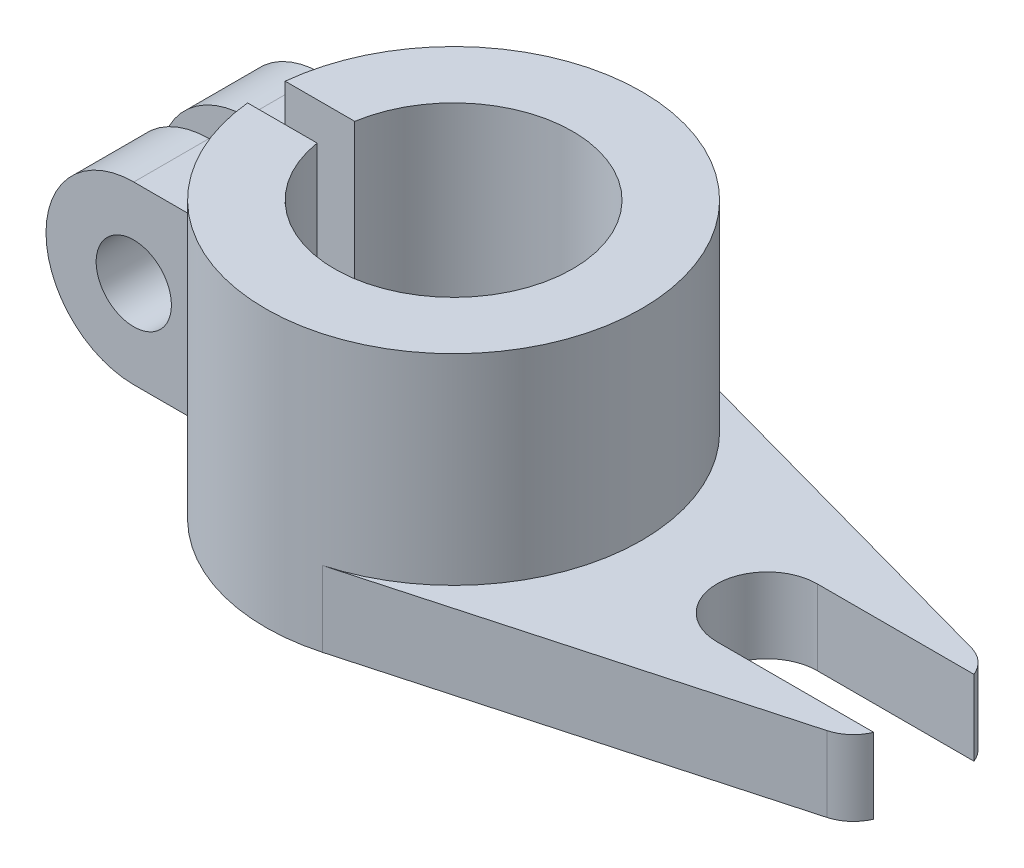
from build123d import *

# Parameters (mm, degrees)
SKETCH1_R           = 30
BOSS_EXTRUDE1_DEPTH = 44
BOSS_EXTRUDE2_DEPTH = 12
BOSS_EXTRUDE3_DEPTH = 15
CUT_EXTRUDE1_DEPTH  = 92.983694207
SKETCH5_R           = 6
CUT_EXTRUDE2_DEPTH  = 98.908120194


with BuildPart() as part:
    # Sketch1 → Boss-Extrude1 (new body)
    with BuildSketch(Plane(origin=(0, 0, 0), x_dir=(1, 0, 0), z_dir=(0, 1, 0))):
        with Locations(Location((0, 0, 0), (0, 0, 270))):
            Circle(SKETCH1_R)
    extrude(amount=BOSS_EXTRUDE1_DEPTH)

    # Sketch2 → Boss-Extrude2 (add)
    with BuildSketch(Plane(origin=(0, 0, 0), x_dir=(1, 0, 0), z_dir=(0, 1, 0))):
        with BuildLine():
            Line((50, 8), (75, 8))
            ThreePointArc((75, 8), (73.430488051, 10.198766547), (71.055490967, 11.486140207))
            Line((71.055490967, 11.486140207), (7.99189246, 28.915906607))
            ThreePointArc((7.99189246, 28.915906607), (30, 0), (7.99189246, -28.915906607))
            Line((7.99189246, -28.915906607), (71.055490967, -11.486140207))
            ThreePointArc((71.055490967, -11.486140207), (73.430488051, -10.198766547), (75, -8))
            Line((75, -8), (50, -8))
            ThreePointArc((50, -8), (42, 0), (50, 8))
        make_face()
    extrude(amount=BOSS_EXTRUDE2_DEPTH)

    # Sketch3 → Boss-Extrude3 (add, symmetric)
    with BuildSketch(Plane.XY):
        with BuildLine():
            Line((-36, 36), (-23.901481141, 36))
            Line((-23.901481141, 36), (-23.901481141, 8))
            Line((-23.901481141, 8), (-36, 8))
            ThreePointArc((-36, 8), (-50, 22), (-36, 36))
        make_face()
    extrude(amount=BOSS_EXTRUDE3_DEPTH, both=True)

    # Sketch4 → Cut-Extrude1 (cut, through all)
    with BuildSketch(Plane(origin=(0, 0, 0), x_dir=(1, 0, 0), z_dir=(0, 1, 0))):
        with BuildLine():
            Line((-72.566045066, 0), (-72.566045066, 3))
            Line((-72.566045066, 3), (-18.761663039, 3))
            ThreePointArc((-18.761663039, 3), (19, 0), (-18.761663039, -3))
            Line((-18.761663039, -3), (-72.566045066, -3))
            Line((-72.566045066, -3), (-72.566045066, 0))
        make_face()
    extrude(amount=CUT_EXTRUDE1_DEPTH, mode=Mode.SUBTRACT)

    # Sketch5 → Cut-Extrude2 (cut, through all)
    with BuildSketch(Plane.XY.offset(15)):
        with Locations((-36, 22)):
            Circle(SKETCH5_R)
    extrude(amount=-CUT_EXTRUDE2_DEPTH, mode=Mode.SUBTRACT)


solid = part.part
